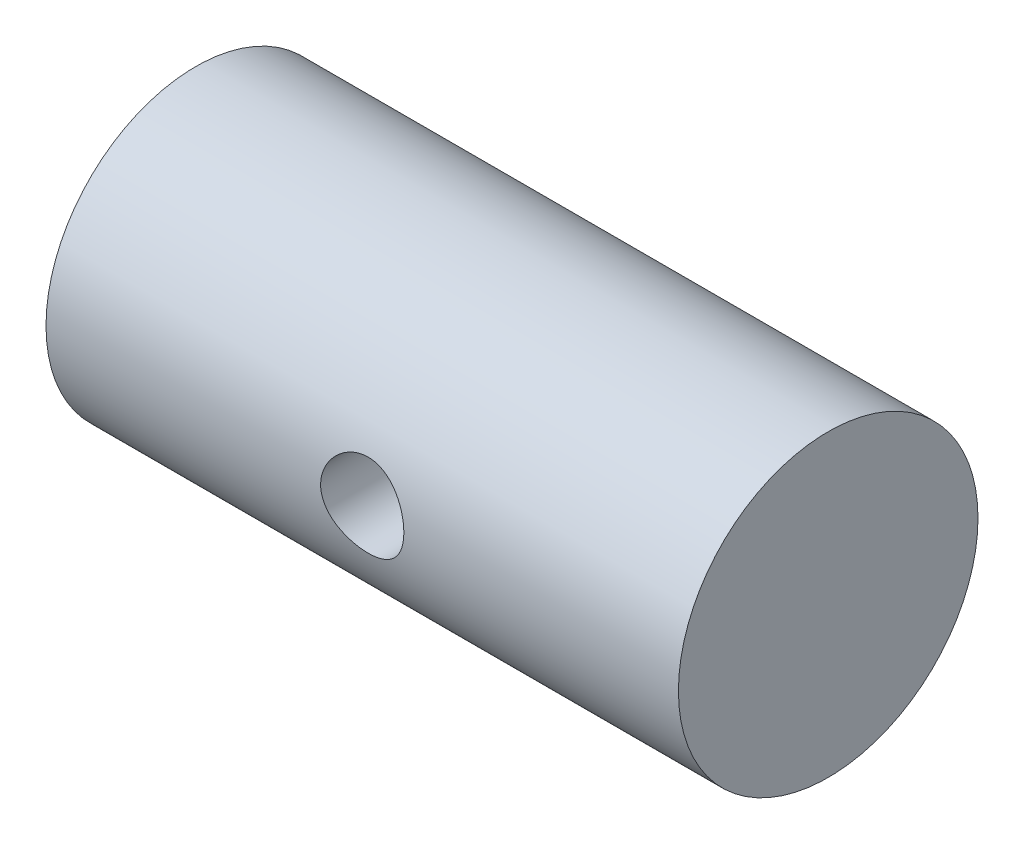
from build123d import *

# Parameters (mm, degrees)
SZKIC1_R                                    = 9
DODANIE_WYCI_GNI_CIE1_DEPTH                 = 38
WYTNIJ_WYCI_GNI_CIE1_REACH                  = 42.075
WYTNIJ_WYCI_GNI_CIE1_END_RADIUS             = 9
SZKIC2_R                                    = 2.5
WYTNIJ_WYCI_GNI_CIE1_DIRECTION_2_REACH      = 42.075
WYTNIJ_WYCI_GNI_CIE1_DIRECTION_2_END_RADIUS = 9


with BuildPart() as part:
    # Szkic1 → Dodanie-wyciągnięcie1 (new body)
    with BuildSketch(Plane(origin=(0, 0, 0), x_dir=(0, 0, -1), z_dir=(1, 0, 0))):
        Circle(SZKIC1_R)
    extrude(amount=DODANIE_WYCI_GNI_CIE1_DEPTH)

    # Wytnij-wyciągnięcie1: up to this cylinder (the profile starts inside it)
    wytnij_wyci_gni_cie1_end = Plane(origin=(19, 0, 0), z_dir=(-1, 0, 0)) * Cylinder(WYTNIJ_WYCI_GNI_CIE1_END_RADIUS, 103.15, mode=Mode.PRIVATE)
    # Szkic2 → Wytnij-wyciągnięcie1 (cut, up to the surface)
    with BuildSketch(Plane.XY, mode=Mode.PRIVATE) as wytnij_wyci_gni_cie1_sk1:
        with Locations(Location((19, 0, 0), (0, 0, 180))):
            Circle(SZKIC2_R)
    wytnij_wyci_gni_cie1_tool1 = extrude(wytnij_wyci_gni_cie1_sk1.sketch, amount=-WYTNIJ_WYCI_GNI_CIE1_REACH, mode=Mode.PRIVATE) & wytnij_wyci_gni_cie1_end
    add(wytnij_wyci_gni_cie1_tool1.solids().sort_by_distance((19, 0, 0))[0], mode=Mode.SUBTRACT)

    # Wytnij-wyciągnięcie1 direction 2: up to this cylinder (the profile starts inside it)
    wytnij_wyci_gni_cie1_direction_2_end = Plane(origin=(19, 0, 0), z_dir=(-1, 0, 0)) * Cylinder(WYTNIJ_WYCI_GNI_CIE1_DIRECTION_2_END_RADIUS, 103.15, mode=Mode.PRIVATE)
    # Szkic2 → Wytnij-wyciągnięcie1 direction 2 (cut, up to the surface)
    with BuildSketch(Plane.XY, mode=Mode.PRIVATE) as wytnij_wyci_gni_cie1_direction_2_sk1:
        with Locations(Location((19, 0, 0), (0, 0, 180))):
            Circle(SZKIC2_R)
    wytnij_wyci_gni_cie1_direction_2_tool1 = extrude(wytnij_wyci_gni_cie1_direction_2_sk1.sketch, amount=WYTNIJ_WYCI_GNI_CIE1_DIRECTION_2_REACH, mode=Mode.PRIVATE) & wytnij_wyci_gni_cie1_direction_2_end
    add(wytnij_wyci_gni_cie1_direction_2_tool1.solids().sort_by_distance((19, 0, 0))[0], mode=Mode.SUBTRACT)


solid = part.part
